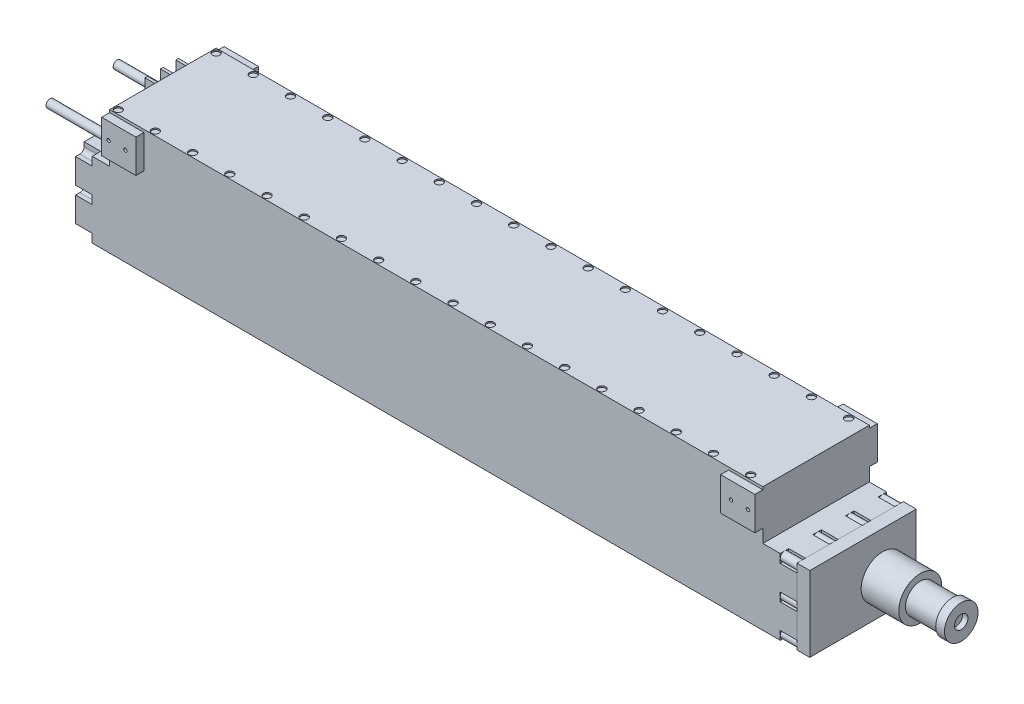
from build123d import *

# Parameters (mm, degrees)
SKETCH_1_W                = 486.3
SKETCH_1_H                = 79.27
EXTRUDE_1_DEPTH           = 36.6
EXTRUDE_2_DEPTH           = 2
SKETCH_3_W                = 2
SKETCH_3_H                = 17
EXTRUDE_3_DEPTH           = 12
PATTERN_LINEAR_1_COUNT    = 3
PATTERN_LINEAR_1_PITCH    = 11.5
SKETCH_4_R                = 2.15
CUT_EXTRUDE_1_DEPTH       = 1
PATTERN_LINEAR_2_COUNT    = 4
PATTERN_LINEAR_2_PITCH    = 11.5
SKETCH_5_R                = 2.75
CUT_EXTRUDE_4_DEPTH       = 1
PATTERN_LINEAR_3_COUNT    = 18
PATTERN_LINEAR_3_PITCH    = 27.7
MIRROR_1_COPY_1_SKETCH_R  = 2.75
MIRROR_1_COPY_1_DEPTH     = 1
MIRROR_1_COPY_2_SKETCH_R  = 2.75
MIRROR_1_COPY_2_DEPTH     = 1
MIRROR_1_COPY_3_SKETCH_R  = 2.75
MIRROR_1_COPY_3_DEPTH     = 1
MIRROR_1_COPY_4_SKETCH_R  = 2.75
MIRROR_1_COPY_4_DEPTH     = 1
MIRROR_1_COPY_5_SKETCH_R  = 2.75
MIRROR_1_COPY_5_DEPTH     = 1
MIRROR_1_COPY_6_SKETCH_R  = 2.75
MIRROR_1_COPY_6_DEPTH     = 1
MIRROR_1_COPY_7_SKETCH_R  = 2.75
MIRROR_1_COPY_7_DEPTH     = 1
MIRROR_1_COPY_8_SKETCH_R  = 2.75
MIRROR_1_COPY_8_DEPTH     = 1
MIRROR_1_COPY_9_SKETCH_R  = 2.75
MIRROR_1_COPY_9_DEPTH     = 1
MIRROR_1_COPY_10_SKETCH_R = 2.75
MIRROR_1_COPY_10_DEPTH    = 1
MIRROR_1_COPY_11_SKETCH_R = 2.75
MIRROR_1_COPY_11_DEPTH    = 1
MIRROR_1_COPY_12_SKETCH_R = 2.75
MIRROR_1_COPY_12_DEPTH    = 1
MIRROR_1_COPY_13_SKETCH_R = 2.75
MIRROR_1_COPY_13_DEPTH    = 1
MIRROR_1_COPY_14_SKETCH_R = 2.75
MIRROR_1_COPY_14_DEPTH    = 1
MIRROR_1_COPY_15_SKETCH_R = 2.75
MIRROR_1_COPY_15_DEPTH    = 1
MIRROR_1_COPY_16_SKETCH_R = 2.75
MIRROR_1_COPY_16_DEPTH    = 1
MIRROR_1_COPY_17_SKETCH_R = 2.75
MIRROR_1_COPY_17_DEPTH    = 1
SKETCH_6_W                = 537
SKETCH_6_H                = 79.27
EXTRUDE_4_DEPTH           = 56
CUT_EXTRUDE_5_DEPTH       = 12.4
MIRROR_3_COPY_1_DEPTH     = 12.4
SKETCH_8_W                = 6
SKETCH_8_H                = 24.8
EXTRUDE_5_DEPTH           = 25.5
HOLE_WIZARD_M3_1_D        = 2.5
SKETCH_12_R               = 3
EXTRUDE_6_DEPTH           = 59
SKETCH_13_W               = 79.27
SKETCH_13_H               = 56
EXTRUDE_7_DEPTH           = 9.6
SKETCH_14_R               = 3.175
EXTRUDE_8_DEPTH           = 12.4
SKETCH_15_R               = 16
EXTRUDE_9_DEPTH           = 28
SKETCH_16_R               = 11
EXTRUDE_10_DEPTH          = 24
SKETCH_17_R               = 12.5
EXTRUDE_11_DEPTH          = 6.5
SKETCH_18_R               = 5
CUT_EXTRUDE_6_DEPTH       = 4


with BuildPart() as part:
    # 草图1 → 凸台-拉伸1 (new body)
    with BuildSketch(Plane(origin=(0, 0, 0), x_dir=(1, 0, 0), z_dir=(0, 1, 0))):
        Rectangle(SKETCH_1_W, SKETCH_1_H)
    extrude(amount=EXTRUDE_1_DEPTH)

    # 草图2 → 凸台-拉伸2 (add)
    with BuildSketch(Plane.ZY.offset(243.15)):
        with BuildLine():
            Line((-28.435, 19.4), (6.065, 19.4))
            ThreePointArc((6.065, 19.4), (10.065, 23.4), (6.065, 27.4))
            Line((6.065, 27.4), (-28.435, 27.4))
            ThreePointArc((-28.435, 27.4), (-32.435, 23.4), (-28.435, 19.4))
        make_face()
    extrude(amount=EXTRUDE_2_DEPTH)

    # 草图3 → 凸台-拉伸3 (add)
    with BuildSketch(Plane.ZY.offset(243.15)):
        with Locations((-22.685, 23.4)):
            Rectangle(SKETCH_3_W, SKETCH_3_H)
    extrude_3 = extrude(amount=EXTRUDE_3_DEPTH)

    # 阵列(线性)1: 凸台-拉伸3 ×3
    with Locations(*[(0, 0, i * PATTERN_LINEAR_1_PITCH) for i in range(1, PATTERN_LINEAR_1_COUNT)]):
        add(extrude_3)

    # 草图4 → 切除-拉伸1 (cut)
    with BuildSketch(Plane.ZY.offset(245.15)):
        with Locations((-28.435, 23.4)):
            Circle(SKETCH_4_R)
    cut_extrude_1 = extrude(amount=-CUT_EXTRUDE_1_DEPTH, mode=Mode.SUBTRACT)

    # 阵列(线性)2: 切除-拉伸1 ×4
    with Locations(*[(0, 0, i * PATTERN_LINEAR_2_PITCH) for i in range(1, PATTERN_LINEAR_2_COUNT)]):
        add(cut_extrude_1, mode=Mode.SUBTRACT)

    # 草图5 → 切除-拉伸4 (cut)
    with BuildSketch(Plane(origin=(0, 36.6, 0), x_dir=(1, 0, 0), z_dir=(0, 1, 0))):
        with Locations(Location((-239.95, 36.435, 0), (0, 0, 270))):
            Circle(SKETCH_5_R)
    cut_extrude_4 = extrude(amount=-CUT_EXTRUDE_4_DEPTH, mode=Mode.SUBTRACT)

    # 阵列(线性)3: 切除-拉伸4 ×18
    with Locations(*[(i * PATTERN_LINEAR_3_PITCH, 0, 0) for i in range(1, PATTERN_LINEAR_3_COUNT)]):
        add(cut_extrude_4, mode=Mode.SUBTRACT)

    # 镜向1: 切除-拉伸4 across plane
    add(cut_extrude_4.mirror(Plane.XY), mode=Mode.SUBTRACT)

    # 镜向1 copy 1 sketch → 镜向1 copy 1 (cut)
    with BuildSketch(Plane(origin=(27.7, 36.6, 0), x_dir=(1, 0, 0), z_dir=(0, 1, 0))):
        with Locations((-239.95, -36.435)):
            Circle(MIRROR_1_COPY_1_SKETCH_R)
    extrude(amount=-MIRROR_1_COPY_1_DEPTH, mode=Mode.SUBTRACT)

    # 镜向1 copy 2 sketch → 镜向1 copy 2 (cut)
    with BuildSketch(Plane(origin=(55.4, 36.6, 0), x_dir=(1, 0, 0), z_dir=(0, 1, 0))):
        with Locations((-239.95, -36.435)):
            Circle(MIRROR_1_COPY_2_SKETCH_R)
    extrude(amount=-MIRROR_1_COPY_2_DEPTH, mode=Mode.SUBTRACT)

    # 镜向1 copy 3 sketch → 镜向1 copy 3 (cut)
    with BuildSketch(Plane(origin=(83.1, 36.6, 0), x_dir=(1, 0, 0), z_dir=(0, 1, 0))):
        with Locations((-239.95, -36.435)):
            Circle(MIRROR_1_COPY_3_SKETCH_R)
    extrude(amount=-MIRROR_1_COPY_3_DEPTH, mode=Mode.SUBTRACT)

    # 镜向1 copy 4 sketch → 镜向1 copy 4 (cut)
    with BuildSketch(Plane(origin=(110.8, 36.6, 0), x_dir=(1, 0, 0), z_dir=(0, 1, 0))):
        with Locations((-239.95, -36.435)):
            Circle(MIRROR_1_COPY_4_SKETCH_R)
    extrude(amount=-MIRROR_1_COPY_4_DEPTH, mode=Mode.SUBTRACT)

    # 镜向1 copy 5 sketch → 镜向1 copy 5 (cut)
    with BuildSketch(Plane(origin=(138.5, 36.6, 0), x_dir=(1, 0, 0), z_dir=(0, 1, 0))):
        with Locations((-239.95, -36.435)):
            Circle(MIRROR_1_COPY_5_SKETCH_R)
    extrude(amount=-MIRROR_1_COPY_5_DEPTH, mode=Mode.SUBTRACT)

    # 镜向1 copy 6 sketch → 镜向1 copy 6 (cut)
    with BuildSketch(Plane(origin=(166.2, 36.6, 0), x_dir=(1, 0, 0), z_dir=(0, 1, 0))):
        with Locations((-239.95, -36.435)):
            Circle(MIRROR_1_COPY_6_SKETCH_R)
    extrude(amount=-MIRROR_1_COPY_6_DEPTH, mode=Mode.SUBTRACT)

    # 镜向1 copy 7 sketch → 镜向1 copy 7 (cut)
    with BuildSketch(Plane(origin=(193.9, 36.6, 0), x_dir=(1, 0, 0), z_dir=(0, 1, 0))):
        with Locations((-239.95, -36.435)):
            Circle(MIRROR_1_COPY_7_SKETCH_R)
    extrude(amount=-MIRROR_1_COPY_7_DEPTH, mode=Mode.SUBTRACT)

    # 镜向1 copy 8 sketch → 镜向1 copy 8 (cut)
    with BuildSketch(Plane(origin=(221.6, 36.6, 0), x_dir=(1, 0, 0), z_dir=(0, 1, 0))):
        with Locations((-239.95, -36.435)):
            Circle(MIRROR_1_COPY_8_SKETCH_R)
    extrude(amount=-MIRROR_1_COPY_8_DEPTH, mode=Mode.SUBTRACT)

    # 镜向1 copy 9 sketch → 镜向1 copy 9 (cut)
    with BuildSketch(Plane(origin=(249.3, 36.6, 0), x_dir=(1, 0, 0), z_dir=(0, 1, 0))):
        with Locations((-239.95, -36.435)):
            Circle(MIRROR_1_COPY_9_SKETCH_R)
    extrude(amount=-MIRROR_1_COPY_9_DEPTH, mode=Mode.SUBTRACT)

    # 镜向1 copy 10 sketch → 镜向1 copy 10 (cut)
    with BuildSketch(Plane(origin=(277, 36.6, 0), x_dir=(1, 0, 0), z_dir=(0, 1, 0))):
        with Locations((-239.95, -36.435)):
            Circle(MIRROR_1_COPY_10_SKETCH_R)
    extrude(amount=-MIRROR_1_COPY_10_DEPTH, mode=Mode.SUBTRACT)

    # 镜向1 copy 11 sketch → 镜向1 copy 11 (cut)
    with BuildSketch(Plane(origin=(304.7, 36.6, 0), x_dir=(1, 0, 0), z_dir=(0, 1, 0))):
        with Locations((-239.95, -36.435)):
            Circle(MIRROR_1_COPY_11_SKETCH_R)
    extrude(amount=-MIRROR_1_COPY_11_DEPTH, mode=Mode.SUBTRACT)

    # 镜向1 copy 12 sketch → 镜向1 copy 12 (cut)
    with BuildSketch(Plane(origin=(332.4, 36.6, 0), x_dir=(1, 0, 0), z_dir=(0, 1, 0))):
        with Locations((-239.95, -36.435)):
            Circle(MIRROR_1_COPY_12_SKETCH_R)
    extrude(amount=-MIRROR_1_COPY_12_DEPTH, mode=Mode.SUBTRACT)

    # 镜向1 copy 13 sketch → 镜向1 copy 13 (cut)
    with BuildSketch(Plane(origin=(360.1, 36.6, 0), x_dir=(1, 0, 0), z_dir=(0, 1, 0))):
        with Locations((-239.95, -36.435)):
            Circle(MIRROR_1_COPY_13_SKETCH_R)
    extrude(amount=-MIRROR_1_COPY_13_DEPTH, mode=Mode.SUBTRACT)

    # 镜向1 copy 14 sketch → 镜向1 copy 14 (cut)
    with BuildSketch(Plane(origin=(387.8, 36.6, 0), x_dir=(1, 0, 0), z_dir=(0, 1, 0))):
        with Locations((-239.95, -36.435)):
            Circle(MIRROR_1_COPY_14_SKETCH_R)
    extrude(amount=-MIRROR_1_COPY_14_DEPTH, mode=Mode.SUBTRACT)

    # 镜向1 copy 15 sketch → 镜向1 copy 15 (cut)
    with BuildSketch(Plane(origin=(415.5, 36.6, 0), x_dir=(1, 0, 0), z_dir=(0, 1, 0))):
        with Locations((-239.95, -36.435)):
            Circle(MIRROR_1_COPY_15_SKETCH_R)
    extrude(amount=-MIRROR_1_COPY_15_DEPTH, mode=Mode.SUBTRACT)

    # 镜向1 copy 16 sketch → 镜向1 copy 16 (cut)
    with BuildSketch(Plane(origin=(443.2, 36.6, 0), x_dir=(1, 0, 0), z_dir=(0, 1, 0))):
        with Locations((-239.95, -36.435)):
            Circle(MIRROR_1_COPY_16_SKETCH_R)
    extrude(amount=-MIRROR_1_COPY_16_DEPTH, mode=Mode.SUBTRACT)

    # 镜向1 copy 17 sketch → 镜向1 copy 17 (cut)
    with BuildSketch(Plane(origin=(470.9, 36.6, 0), x_dir=(1, 0, 0), z_dir=(0, 1, 0))):
        with Locations((-239.95, -36.435)):
            Circle(MIRROR_1_COPY_17_SKETCH_R)
    extrude(amount=-MIRROR_1_COPY_17_DEPTH, mode=Mode.SUBTRACT)

    # 草图6 → 凸台-拉伸4 (add)
    with BuildSketch(Plane.XZ):
        Rectangle(SKETCH_6_W, SKETCH_6_H)
    extrude(amount=EXTRUDE_4_DEPTH)

    # 草图7 → 切除-拉伸5 (cut)
    with BuildSketch(Plane.ZY.offset(268.5)):
        with BuildLine():
            Line((-15.3183, -3.175), (-15.3183, 0))
            Line((-15.3183, 0), (-8.9683, 0))
            Line((-8.9683, 0), (-8.9683, -3.175))
            ThreePointArc((-8.9683, -3.175), (-12.1433, -6.35), (-15.3183, -3.175))
        make_face()
        with BuildLine():
            Line((-39.635, 0), (-33.285, 0))
            Line((-33.285, 0), (-33.285, -3.175))
            ThreePointArc((-33.285, -3.175), (-34.21493597, -5.42006403), (-36.46, -6.35))
            Line((-36.46, -6.35), (-39.635, -6.35))
            Line((-39.635, -6.35), (-39.635, 0))
        make_face()
        with BuildLine():
            Line((8.9984, -3.175), (8.9984, 0))
            Line((8.9984, 0), (15.3484, 0))
            Line((15.3484, 0), (15.3484, -3.175))
            ThreePointArc((15.3484, -3.175), (12.1734, -6.35), (8.9984, -3.175))
        make_face()
        with BuildLine():
            Line((39.635, 0), (39.635, -6.35))
            Line((39.635, -6.35), (36.46, -6.35))
            ThreePointArc((36.46, -6.35), (34.21493597, -5.42006403), (33.285, -3.175))
            Line((33.285, -3.175), (33.285, 0))
            Line((33.285, 0), (39.635, 0))
        make_face()
        with BuildLine():
            Line((-36.46, -24.825), (-39.635, -24.825))
            Line((-39.635, -24.825), (-39.635, -31.175))
            Line((-39.635, -31.175), (-36.46, -31.175))
            ThreePointArc((-36.46, -31.175), (-33.285, -28), (-36.46, -24.825))
        make_face()
        with BuildLine():
            Line((36.46, -24.825), (39.635, -24.825))
            Line((39.635, -24.825), (39.635, -31.175))
            Line((39.635, -31.175), (36.46, -31.175))
            ThreePointArc((36.46, -31.175), (33.285, -28), (36.46, -24.825))
        make_face()
    cut_extrude_5 = extrude(amount=-CUT_EXTRUDE_5_DEPTH, mode=Mode.SUBTRACT)

    # 镜向2: 切除-拉伸5 across plane
    add(cut_extrude_5.mirror(Plane.ZX.offset(-28)), mode=Mode.SUBTRACT)

    # 镜向3: 切除-拉伸5 across plane
    add(cut_extrude_5.mirror(Plane(origin=(0, 0, 0), x_dir=(0, 0, 1), z_dir=(1, 0, 0))), mode=Mode.SUBTRACT)

    # 镜向3 copy 1 sketch → 镜向3 copy 1 (cut)
    with BuildSketch(Plane(origin=(268.5, -56, 0), x_dir=(0, 0, 1), z_dir=(1, 0, 0))):
        with BuildLine():
            Line((-15.3183, -3.175), (-15.3183, 0))
            Line((-15.3183, 0), (-8.9683, 0))
            Line((-8.9683, 0), (-8.9683, -3.175))
            ThreePointArc((-8.9683, -3.175), (-12.1433, -6.35), (-15.3183, -3.175))
        make_face()
        with BuildLine():
            Line((-39.635, 0), (-33.285, 0))
            Line((-33.285, 0), (-33.285, -3.175))
            ThreePointArc((-33.285, -3.175), (-34.21493597, -5.42006403), (-36.46, -6.35))
            Line((-36.46, -6.35), (-39.635, -6.35))
            Line((-39.635, -6.35), (-39.635, 0))
        make_face()
        with BuildLine():
            Line((8.9984, -3.175), (8.9984, 0))
            Line((8.9984, 0), (15.3484, 0))
            Line((15.3484, 0), (15.3484, -3.175))
            ThreePointArc((15.3484, -3.175), (12.1734, -6.35), (8.9984, -3.175))
        make_face()
        with BuildLine():
            Line((39.635, 0), (39.635, -6.35))
            Line((39.635, -6.35), (36.46, -6.35))
            ThreePointArc((36.46, -6.35), (34.21493597, -5.42006403), (33.285, -3.175))
            Line((33.285, -3.175), (33.285, 0))
            Line((33.285, 0), (39.635, 0))
        make_face()
        with BuildLine():
            Line((-36.46, -24.825), (-39.635, -24.825))
            Line((-39.635, -24.825), (-39.635, -31.175))
            Line((-39.635, -31.175), (-36.46, -31.175))
            ThreePointArc((-36.46, -31.175), (-33.285, -28), (-36.46, -24.825))
        make_face()
        with BuildLine():
            Line((36.46, -24.825), (39.635, -24.825))
            Line((39.635, -24.825), (39.635, -31.175))
            Line((39.635, -31.175), (36.46, -31.175))
            ThreePointArc((36.46, -31.175), (33.285, -28), (36.46, -24.825))
        make_face()
    extrude(amount=-MIRROR_3_COPY_1_DEPTH, mode=Mode.SUBTRACT)

    # 草图8 → 凸台-拉伸5 (add)
    with BuildSketch(Plane.ZY.offset(243.15)):
        with Locations((-42.577702879, 22.2)):
            Rectangle(SKETCH_8_W, SKETCH_8_H)
        with Locations((42.577702879, 22.2)):
            Rectangle(SKETCH_8_W, SKETCH_8_H)
    extrude_5 = extrude(amount=-EXTRUDE_5_DEPTH)

    # M3 螺纹孔1 (through all)
    with Locations(Plane(origin=(0, 0, -45.577702879), x_dir=(-1, 0, 0), z_dir=(0, 0, -1))):
        with Locations((225.45, 22.2), (237.95, 22.2)):
            hole_wizard_m3_1 = Hole(HOLE_WIZARD_M3_1_D / 2)

    # 镜向5: 凸台-拉伸5, M3 螺纹孔1 across plane
    add(extrude_5.mirror(Plane(origin=(0, 0, 0), x_dir=(0, 0, 1), z_dir=(1, 0, 0))))
    add(hole_wizard_m3_1.mirror(Plane(origin=(0, 0, 0), x_dir=(0, 0, 1), z_dir=(1, 0, 0))), mode=Mode.SUBTRACT)

    # 草图12 → 凸台-拉伸6 (add)
    with BuildSketch(Plane.ZY.offset(243.15)):
        with Locations(Location((-25, 3.8, 0), (0, 0, 180))):
            Circle(SKETCH_12_R)
        with Locations(Location((25, 3.8, 0), (0, 0, 180))):
            Circle(SKETCH_12_R)
    extrude(amount=EXTRUDE_6_DEPTH)

    # 草图14 → 凸台-拉伸8 (add)
    with BuildSketch(Plane(origin=(268.5, 0, 0), x_dir=(0, 0, -1), z_dir=(1, 0, 0))):
        with Locations((-36.46, -3.175)):
            Circle(SKETCH_14_R)
        with Locations((-12.1734, -3.175)):
            Circle(SKETCH_14_R)
        with Locations((12.1433, -3.175)):
            Circle(SKETCH_14_R)
        with Locations((36.46, -3.175)):
            Circle(SKETCH_14_R)
        with Locations((36.46, -28)):
            Circle(SKETCH_14_R)
        with Locations((36.46, -52.825)):
            Circle(SKETCH_14_R)
        with Locations((12.1433, -52.825)):
            Circle(SKETCH_14_R)
        with Locations((-12.1734, -52.825)):
            Circle(SKETCH_14_R)
        with Locations((-36.46, -52.825)):
            Circle(SKETCH_14_R)
        with Locations((-36.46, -28)):
            Circle(SKETCH_14_R)
    extrude(amount=-EXTRUDE_8_DEPTH)


with BuildPart() as body_2:
    # 草图13 → 凸台-拉伸7 (new body)
    with BuildSketch(Plane(origin=(278.1, 0, 0), x_dir=(0, 0, -1), z_dir=(1, 0, 0))):
        with Locations((0, -28)):
            Rectangle(SKETCH_13_W, SKETCH_13_H)
    extrude(amount=-EXTRUDE_7_DEPTH)

    # 草图15 → 凸台-拉伸9 (add)
    with BuildSketch(Plane(origin=(278.1, 0, 0), x_dir=(0, 0, -1), z_dir=(1, 0, 0))):
        with Locations((14.635, -31)):
            Circle(SKETCH_15_R)
    extrude(amount=EXTRUDE_9_DEPTH)

    # 草图16 → 凸台-拉伸10 (add)
    with BuildSketch(Plane(origin=(306.1, 0, 0), x_dir=(0, 0, -1), z_dir=(1, 0, 0))):
        with Locations((14.635, -31)):
            Circle(SKETCH_16_R)
    extrude(amount=EXTRUDE_10_DEPTH)

    # 草图17 → 凸台-拉伸11 (add)
    with BuildSketch(Plane(origin=(330.1, 0, 0), x_dir=(0, 0, -1), z_dir=(1, 0, 0))):
        with Locations(Location((14.635, -31, 0), (0, 0, 180))):
            Circle(SKETCH_17_R)
    extrude(amount=EXTRUDE_11_DEPTH)

    # 草图18 → 切除-拉伸6 (cut)
    with BuildSketch(Plane(origin=(336.6, 0, 0), x_dir=(0, 0, -1), z_dir=(1, 0, 0))):
        with Locations((14.635, -31)):
            Circle(SKETCH_18_R)
    extrude(amount=-CUT_EXTRUDE_6_DEPTH, mode=Mode.SUBTRACT)


solid = Compound([part.part, body_2.part])
